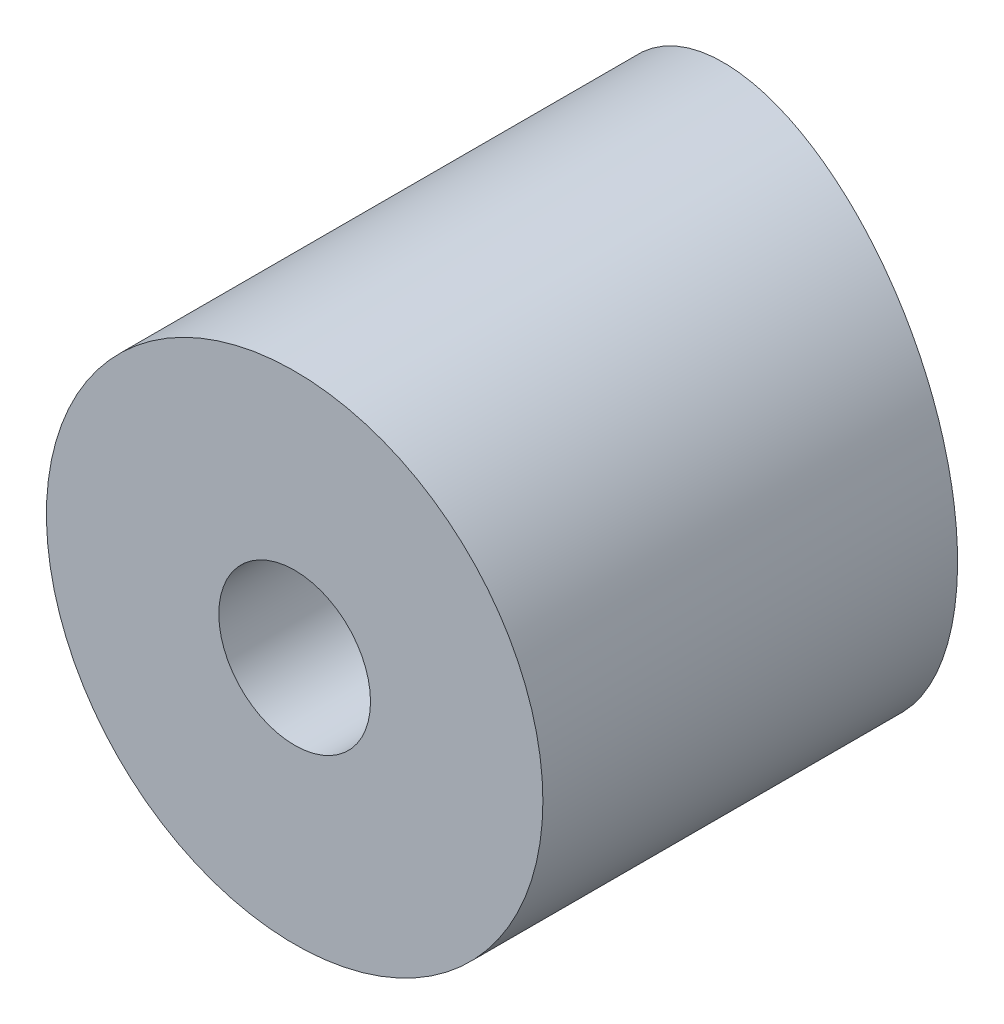
from build123d import *

# Parameters (mm, degrees)
SKETCH1_R           = 3.6
SKETCH1_R_2         = 1.1
BOSS_EXTRUDE1_DEPTH = 18.98


with BuildPart() as part:
    # Sketch1 → Boss-Extrude1 (new body)
    with BuildSketch(Plane.XY):
        with Locations((-3, 0)):
            Circle(SKETCH1_R)
        with Locations((-3, 0)):
            Circle(SKETCH1_R_2, mode=Mode.SUBTRACT)
    extrude(amount=BOSS_EXTRUDE1_DEPTH)

    # Sketch2 → Cut-Revolve1 (revolve, cut)
    with BuildSketch(Plane.XY):
        with BuildLine():
            ThreePointArc((0, -12.98), (12.98, 0), (0, 12.98))
            Line((0, 12.98), (0, -12.98))
        make_face()
    revolve(axis=Axis((0, 14.366525119, 0), (0, -1, 0)), mode=Mode.SUBTRACT)


solid = part.part
